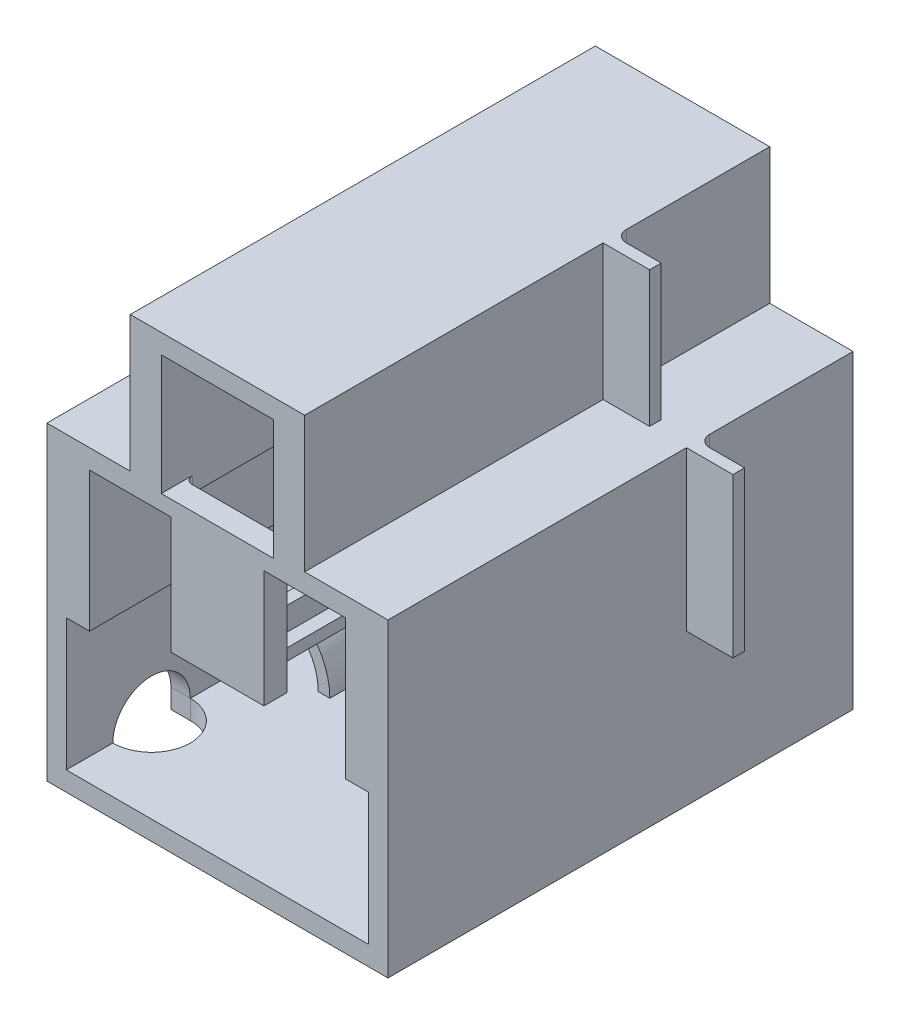
from build123d import *

# Parameters (mm, degrees)
BOSS_EXTRUDE1_DEPTH             = 60
SHELL1_T                        = -2.5
SKETCH2_W                       = 1.5
SKETCH2_H                       = 17.5
BOSS_EXTRUDE2_DEPTH             = 57.5
SKETCH4_W                       = 3
SKETCH4_H                       = 18
BOSS_EXTRUDE4_DEPTH             = 57.5
BOSS_EXTRUDE5_DEPTH             = 5
SKETCH13_W                      = 1.5
SKETCH13_H                      = 20.5
BOSS_EXTRUDE8_DEPTH             = 6
SKETCH14_W                      = 17.5
SKETCH14_H                      = 1.5
BOSS_EXTRUDE9_DEPTH             = 6
SKETCH15_W                      = 1.5
SKETCH15_H                      = 20.5
BOSS_EXTRUDE10_DEPTH            = 6
FILLET7_R                       = 1.5
CUT_EXTRUDE9_REACH              = 89.694
CUT_EXTRUDE9_DIRECTION_2_REACH  = 89.694
CUT_EXTRUDE10_REACH             = 88.076
CUT_EXTRUDE10_DIRECTION_2_REACH = 88.076
SKETCH27_W                      = 5
SKETCH27_H                      = 17
BOSS_EXTRUDE15_DEPTH            = 2.5
BOSS_EXTRUDE16_DEPTH            = 5.5
SKETCH29_W                      = 9.25
SKETCH29_H                      = 1.666666667
BOSS_EXTRUDE17_DEPTH            = 2.5
SKETCH30_W                      = 3.942307692
SKETCH30_H                      = 17.5
BOSS_EXTRUDE18_DEPTH            = 4
SKETCH31_W                      = 5
SKETCH31_H                      = 17
BOSS_EXTRUDE19_DEPTH            = 2.5
SKETCH32_W                      = 4.464285714
SKETCH32_H                      = 20.5
BOSS_EXTRUDE20_DEPTH            = 5.5
SKETCH35_W                      = 9.25
SKETCH35_H                      = 1.666666667
BOSS_EXTRUDE21_DEPTH            = 2.5
SKETCH36_W                      = 1.428571429
SKETCH36_H                      = 17.5
BOSS_EXTRUDE22_DEPTH            = 4
SKETCH37_W                      = 15.607142857
SKETCH37_H                      = 3.429487179
BOSS_EXTRUDE23_DEPTH            = 2.5
SKETCH38_W                      = 39
SKETCH38_H                      = 5
BOSS_EXTRUDE24_DEPTH            = 2.5
SKETCH39_W                      = 15
SKETCH39_H                      = 1.5
REVOLVE1_ANGLE                  = 90
CUT_EXTRUDE11_DEPTH             = 10
CUT_EXTRUDE12_DEPTH             = 10
BOSS_EXTRUDE25_DEPTH            = 3
BOSS_EXTRUDE26_START            = -2.5
SKETCH43_W                      = 12.25
SKETCH43_H                      = 3.571428571
BOSS_EXTRUDE26_DEPTH            = 2.5
BOSS_EXTRUDE27_REACH            = 87.669
FILLET8_R                       = 1


with BuildPart() as part:
    # Sketch1 → Boss-Extrude1 (new body)
    with BuildSketch(Plane.XY):
        Polygon((-22, 0), (22, 0), (22, 40), (11.25, 40), (11.25, 57.5), (-11.25, 57.5), (-11.25, 40), (-22, 40), align=None)
    extrude(amount=BOSS_EXTRUDE1_DEPTH)

    # Shell1
    shell1_openings = [part.faces().sort_by_distance(p)[0] for p in [
        (0, 25.256094022, 60),
    ]]
    offset(amount=SHELL1_T, openings=shell1_openings, kind=Kind.INTERSECTION)

    # Sketch2 → Boss-Extrude2 (add)
    with BuildSketch(Plane.XY.offset(2.5)):
        with Locations((-8, 46.25)):
            Rectangle(SKETCH2_W, SKETCH2_H)
        with Locations((8, 46.25)):
            Rectangle(SKETCH2_W, SKETCH2_H)
    extrude(amount=BOSS_EXTRUDE2_DEPTH)

    # Sketch4 → Boss-Extrude4 (add)
    with BuildSketch(Plane.XY.offset(2.5)):
        with Locations((-18, 28.5)):
            Rectangle(SKETCH4_W, SKETCH4_H)
        with Locations((18, 28.5)):
            Rectangle(SKETCH4_W, SKETCH4_H)
    extrude(amount=BOSS_EXTRUDE4_DEPTH)

    # Sketch7 → Boss-Extrude5 (add)
    with BuildSketch(Plane.XY.offset(2.5)):
        Polygon((-7.25, 55), (7.25, 55), (7.25, 37.5), (16.5, 37.5), (16.5, 19.5), (19.5, 19.5), (19.5, 2.5), (-19.5, 2.5), (-19.5, 19.5), (-16.5, 19.5), (-16.5, 37.5), (-7.25, 37.5), align=None)
    extrude(amount=BOSS_EXTRUDE5_DEPTH)

    # Sketch13 → Boss-Extrude8 (add)
    with BuildSketch(Plane.ZY.offset(22)):
        with Locations((20.75, 29.75)):
            Rectangle(SKETCH13_W, SKETCH13_H)
    extrude(amount=BOSS_EXTRUDE8_DEPTH)

    # Sketch14 → Boss-Extrude9 (add)
    with BuildSketch(Plane(origin=(11.25, 46.25, 0), x_dir=(0, 1, 0), z_dir=(-1, 0, 0))):
        with Locations((2.5, -20.75)):
            Rectangle(SKETCH14_W, SKETCH14_H)
    extrude(amount=-BOSS_EXTRUDE9_DEPTH)

    # Sketch15 → Boss-Extrude10 (add)
    with BuildSketch(Plane(origin=(22, 0, 0), x_dir=(0, 0, -1), z_dir=(1, 0, 0))):
        with Locations((-20.75, 29.75)):
            Rectangle(SKETCH15_W, SKETCH15_H)
    extrude(amount=BOSS_EXTRUDE10_DEPTH)

    # Fillet7
    fillet7_edges = [part.edges().sort_by_distance(p)[0] for p in [
        (-22, 29.75, 20),
        (11.25, 48.75, 20),
        (22, 29.75, 20),
    ]]
    fillet(fillet7_edges, radius=FILLET7_R)

    # Sketch26 → Cut-Extrude9 (cut, up to next)
    with BuildSketch(Plane(origin=(0, 0, 0), x_dir=(0, 0, -1), z_dir=(1, 0, 0)), mode=Mode.PRIVATE) as cut_extrude9_sk1:
        Polygon((-7.5, 55), (-7.5, 2.5), (-2.5, 2.5), align=None)
    cut_extrude9_tool1 = extrude(cut_extrude9_sk1.sketch, amount=-CUT_EXTRUDE9_REACH, mode=Mode.PRIVATE) & part.part
    add(cut_extrude9_tool1.solids().sort_by_distance((0, 20, 5.833333))[0], mode=Mode.SUBTRACT)

    # Sketch26 → Cut-Extrude9 direction 2 (cut, up to next)
    with BuildSketch(Plane(origin=(0, 0, 0), x_dir=(0, 0, -1), z_dir=(1, 0, 0)), mode=Mode.PRIVATE) as cut_extrude9_direction_2_sk1:
        Polygon((-7.5, 55), (-7.5, 2.5), (-2.5, 2.5), align=None)
    cut_extrude9_direction_2_tool1 = extrude(cut_extrude9_direction_2_sk1.sketch, amount=CUT_EXTRUDE9_DIRECTION_2_REACH, mode=Mode.PRIVATE) & part.part
    add(cut_extrude9_direction_2_tool1.solids().sort_by_distance((0, 20, 5.833333))[0], mode=Mode.SUBTRACT)

    # Sketch33 → Cut-Extrude10 (cut, up to next)
    with BuildSketch(Plane(origin=(0, 2.5, 0), x_dir=(1, 0, 0), z_dir=(0, 1, 0)), mode=Mode.PRIVATE) as cut_extrude10_sk1:
        Polygon((-19.5, -7.5), (19.5, -7.5), (-19.5, -2.5), align=None)
    cut_extrude10_tool1 = extrude(cut_extrude10_sk1.sketch, amount=CUT_EXTRUDE10_REACH, mode=Mode.PRIVATE) & part.part
    add(cut_extrude10_tool1.solids().sort_by_distance((-6.5, 2.5, 5.833333))[0], mode=Mode.SUBTRACT)

    # Sketch33 → Cut-Extrude10 direction 2 (cut, up to next)
    with BuildSketch(Plane(origin=(0, 2.5, 0), x_dir=(1, 0, 0), z_dir=(0, 1, 0)), mode=Mode.PRIVATE) as cut_extrude10_direction_2_sk1:
        Polygon((-19.5, -7.5), (19.5, -7.5), (-19.5, -2.5), align=None)
    cut_extrude10_direction_2_tool1 = extrude(cut_extrude10_direction_2_sk1.sketch, amount=-CUT_EXTRUDE10_DIRECTION_2_REACH, mode=Mode.PRIVATE) & part.part
    add(cut_extrude10_direction_2_tool1.solids().sort_by_distance((-6.5, 2.5, 5.833333))[0], mode=Mode.SUBTRACT)

    # Sketch27 → Boss-Extrude15 (add)
    with BuildSketch(Plane.ZY.offset(22)):
        with Locations((5, 11)):
            Rectangle(SKETCH27_W, SKETCH27_H)
    extrude(amount=-BOSS_EXTRUDE15_DEPTH)

    # Sketch27<4> → Boss-Extrude16 (add)
    with BuildSketch(Plane.ZY.offset(22)):
        Polygon((4.119047619, 19.5), (7.5, 19.5), (7.5, 40), (6.071428571, 40), align=None)
    extrude(amount=-BOSS_EXTRUDE16_DEPTH)

    # Sketch29 → Boss-Extrude17 (add)
    with BuildSketch(Plane.XZ.offset(-37.5)):
        with Locations((-11.875, 6.666666667)):
            Rectangle(SKETCH29_W, SKETCH29_H)
    extrude(amount=-BOSS_EXTRUDE17_DEPTH)

    # Sketch30 → Boss-Extrude18 (add)
    with BuildSketch(Plane.ZY.offset(11.25)):
        with Locations((5.528846154, 48.75)):
            Rectangle(SKETCH30_W, SKETCH30_H)
    extrude(amount=-BOSS_EXTRUDE18_DEPTH)

    # Sketch31 → Boss-Extrude19 (add)
    with BuildSketch(Plane.ZY.offset(-19.5)):
        with Locations((5, 11)):
            Rectangle(SKETCH31_W, SKETCH31_H)
    extrude(amount=-BOSS_EXTRUDE19_DEPTH)

    # Sketch32 → Boss-Extrude20 (add)
    with BuildSketch(Plane(origin=(22, 0, 0), x_dir=(0, 0, -1), z_dir=(1, 0, 0))):
        with Locations((-5.267857143, 29.75)):
            Rectangle(SKETCH32_W, SKETCH32_H)
    extrude(amount=-BOSS_EXTRUDE20_DEPTH)

    # Sketch35 → Boss-Extrude21 (add)
    with BuildSketch(Plane.XZ.offset(-37.5)):
        with Locations((11.875, 6.666666667)):
            Rectangle(SKETCH35_W, SKETCH35_H)
    extrude(amount=-BOSS_EXTRUDE21_DEPTH)

    # Sketch36 → Boss-Extrude22 (add)
    with BuildSketch(Plane(origin=(11.25, 0, 0), x_dir=(0, 0, -1), z_dir=(1, 0, 0))):
        with Locations((-6.785714286, 48.75)):
            Rectangle(SKETCH36_W, SKETCH36_H)
    extrude(amount=-BOSS_EXTRUDE22_DEPTH)

    # Sketch37 → Boss-Extrude23 (add)
    with BuildSketch(Plane(origin=(0, 57.5, 0), x_dir=(1, 0, 0), z_dir=(0, 1, 0))):
        with Locations((0.553571429, -5.785256411)):
            Rectangle(SKETCH37_W, SKETCH37_H)
    extrude(amount=-BOSS_EXTRUDE23_DEPTH)

    # Sketch38 → Boss-Extrude24 (add)
    with BuildSketch(Plane.XZ):
        with Locations((0, 5)):
            Rectangle(SKETCH38_W, SKETCH38_H)
    extrude(amount=-BOSS_EXTRUDE24_DEPTH)

    # Sketch39 → Revolve1 (revolve)
    with BuildSketch(Plane(origin=(-19.5, 0, 0), x_dir=(0, 0, -1), z_dir=(1, 0, 0))):
        with Locations((-27.5, 10.75)):
            Rectangle(SKETCH39_W, SKETCH39_H)
    revolve(axis=Axis((-19.5, 2.5, 60), (0, 0, -1)), revolution_arc=REVOLVE1_ANGLE)

    # Sketch40 → Cut-Extrude11 (cut)
    with BuildSketch(Plane(origin=(-19.5, 0, 0), x_dir=(0, 0, -1), z_dir=(1, 0, 0))):
        with BuildLine():
            Line((-54, 2.5), (-44, 2.5))
            ThreePointArc((-44, 2.5), (-49, 7.5), (-54, 2.5))
        make_face()
    extrude(amount=-CUT_EXTRUDE11_DEPTH, mode=Mode.SUBTRACT)

    # Sketch41 → Cut-Extrude12 (cut)
    with BuildSketch(Plane(origin=(0, 2.5, 0), x_dir=(1, 0, 0), z_dir=(0, 1, 0))):
        with BuildLine():
            Line((-22, -44), (-19.5, -44))
            ThreePointArc((-19.5, -44), (-14.5, -49), (-19.5, -54))
            Line((-19.5, -54), (-22, -54))
            Line((-22, -54), (-22, -44))
        make_face()
    extrude(amount=-CUT_EXTRUDE12_DEPTH, mode=Mode.SUBTRACT)

    # Sketch42 → Boss-Extrude25 (add)
    with BuildSketch(Plane.XY.offset(60)):
        Polygon((-7.25, 39.5), (7.25, 39.5), (7.25, 37.5), (6, 37.5), (6, 22.4), (-6, 22.4), (-6, 37.5), (-7.25, 37.5), align=None)
    extrude(amount=-BOSS_EXTRUDE25_DEPTH)

    # Sketch43 → Boss-Extrude26 (add)
    with BuildSketch(Plane(origin=(0, 40, 0), x_dir=(1, 0, 0), z_dir=(0, 1, 0)).offset(BOSS_EXTRUDE26_START)):
        with Locations((-13.375, -4.285714286)):
            Rectangle(SKETCH43_W, SKETCH43_H)
    extrude(amount=BOSS_EXTRUDE26_DEPTH)

    # Boss-Extrude27: up to this plane
    boss_extrude27_end = Plane(origin=(28.001, 55, 7.5), z_dir=(0, -0.09480909262799542, 0.9954954725939523))
    # Sketch44 → Boss-Extrude27 (add, up to the surface)
    with BuildSketch(Plane(origin=(0, 0, 57), x_dir=(-1, 0, 0), z_dir=(0, 0, -1)), mode=Mode.PRIVATE) as boss_extrude27_sk1:
        Polygon((-2.5, 22.4), (-2.5, 23.9), (-0.75, 23.9), (-0.75, 26.9), (0.75, 26.9), (0.75, 23.9), (2.5, 23.9), (2.5, 22.4), align=None)
    boss_extrude27_tool1 = split(extrude(boss_extrude27_sk1.sketch, amount=BOSS_EXTRUDE27_REACH, mode=Mode.PRIVATE), bisect_by=boss_extrude27_end, keep=Keep.BOTH, mode=Mode.PRIVATE)
    add(boss_extrude27_tool1.solids().sort_by_distance((0, 23.99375, 57))[0])

    # Fillet8
    fillet8_edges = [part.edges().sort_by_distance(p)[0] for p in [
        (-7.25, 38.5, 57),
        (7.25, 38.5, 57),
        (1.625, 23.9, 57),
        (0.75, 25.4, 57),
        (0, 26.9, 57),
        (-0.75, 25.4, 57),
        (-1.625, 23.9, 57),
        (2.5, 23.15, 57),
        (-2.5, 23.15, 57),
    ]]
    fillet(fillet8_edges, radius=FILLET8_R)


solid = part.part
